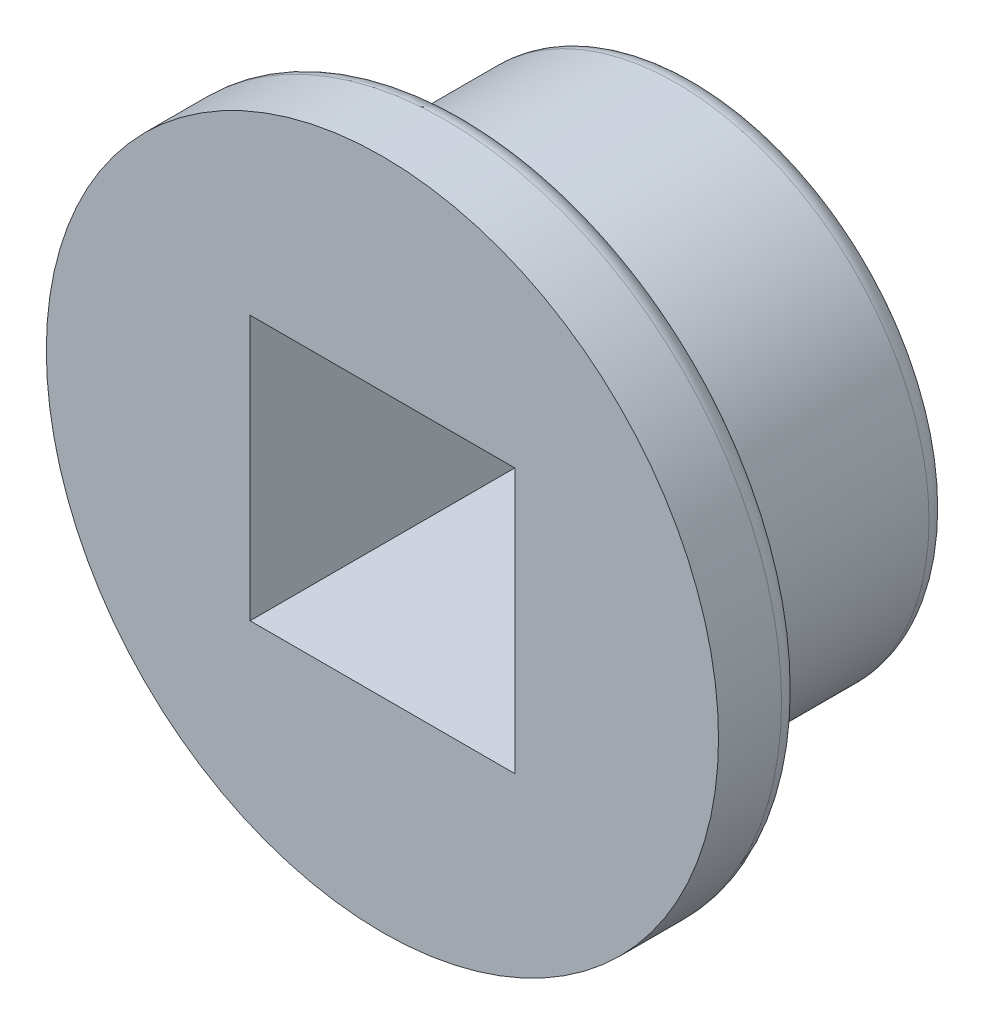
from build123d import *

# Parameters (mm, degrees)
SKETCH1_R           = 6.01
SKETCH1_W           = 6.3
SKETCH1_H           = 6.3
BOSS_EXTRUDE1_DEPTH = 5.5
SKETCH1_3_R         = 8
SKETCH1_3_W         = 6.3
SKETCH1_3_H         = 6.3
BOSS_EXTRUDE2_DEPTH = 2
FILLET1_R           = 0.5


with BuildPart() as part:
    # Sketch1 → Boss-Extrude1 (new body)
    with BuildSketch(Plane.XY):
        Circle(SKETCH1_R)
        Rectangle(SKETCH1_W, SKETCH1_H, mode=Mode.SUBTRACT)
    extrude(amount=-BOSS_EXTRUDE1_DEPTH)

    # Sketch1<3> → Boss-Extrude2 (add)
    with BuildSketch(Plane.XY):
        Circle(SKETCH1_3_R)
        Rectangle(SKETCH1_3_W, SKETCH1_3_H, mode=Mode.SUBTRACT)
    extrude(amount=BOSS_EXTRUDE2_DEPTH)

    # Fillet1
    fillet1_edges = [part.edges().sort_by_distance(p)[0] for p in [
        (-8, 0, 0),
        (-6.01, 0, -5.5),
    ]]
    fillet(fillet1_edges, radius=FILLET1_R)


solid = part.part
